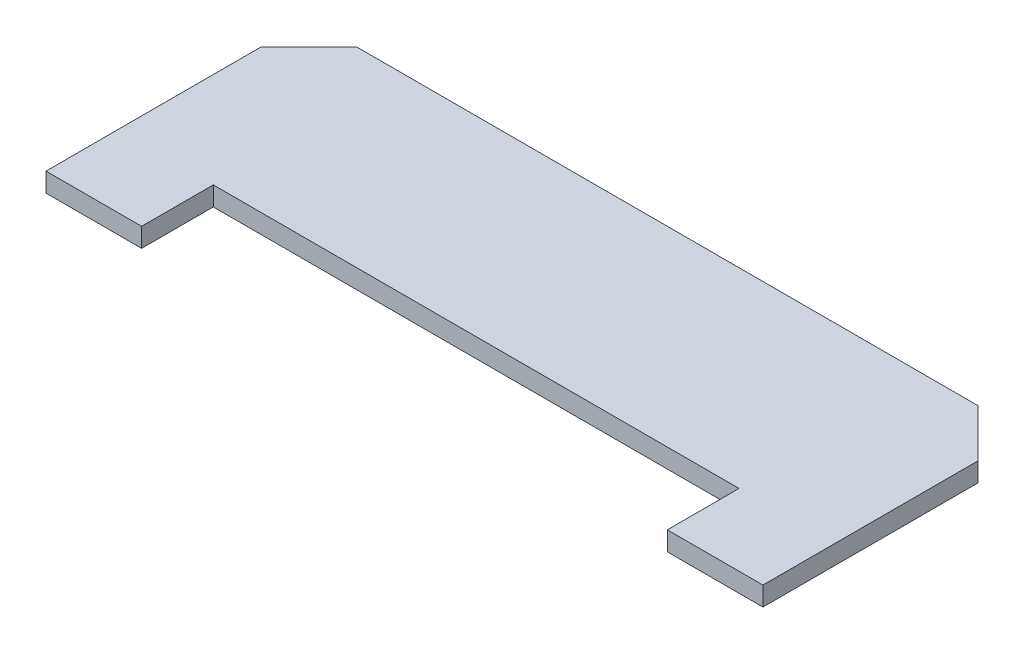
from build123d import *

# Parameters (mm, degrees)
BODY_DEPTH = 4


with BuildPart() as part:
    # Sketch1 → body (new body)
    with BuildSketch(Plane(origin=(0, 0, 0), x_dir=(1, 0, 0), z_dir=(0, 1, 0))):
        Polygon((3.416948794, -10), (13.416948794, 0), (143.416948794, 0), (153.416948794, -10), (153.416948794, -55), (133.416948794, -55), (133.416948794, -40), (23.416948794, -40), (23.416948794, -55), (3.416948794, -55), align=None)
    extrude(amount=BODY_DEPTH)


solid = part.part
